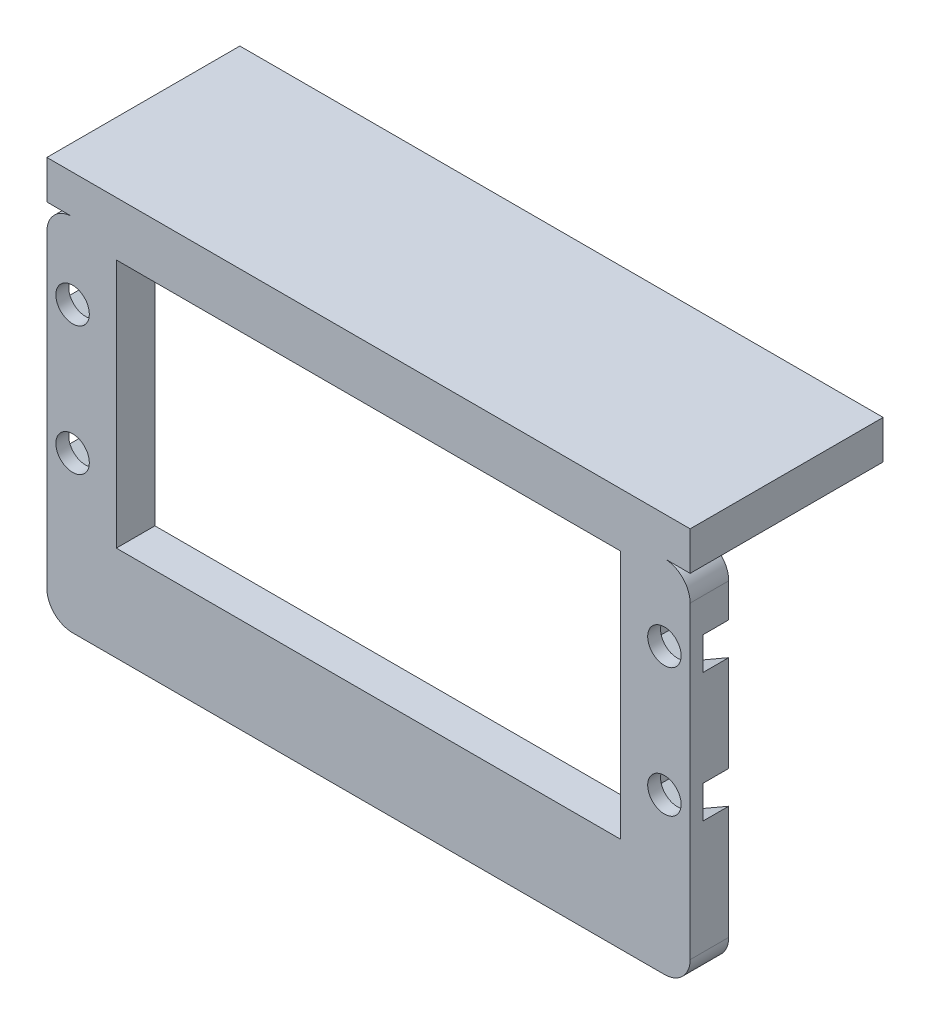
from build123d import *

# Parameters (mm, degrees)
BOSS_EXTRUDE1_DEPTH     = 3
CUT_EXTRUDE1_DEPTH      = 38.656340768
CUT_EXTRUDE1_DEPTH_BACK = 38.656340768
SKETCH2_W               = 39.2
SKETCH2_H               = 19.4
CUT_EXTRUDE2_DEPTH      = 38.656340768
CUT_EXTRUDE2_DEPTH_BACK = 38.656340768
SKETCH3_R               = 1.3
CUT_EXTRUDE3_DEPTH      = 2
SKETCH5_W               = 50
SKETCH5_H               = 15
BOSS_EXTRUDE2_DEPTH     = 3


with BuildPart() as part:
    # Sketch1 → Boss-Extrude1 (new body)
    with BuildSketch(Plane.XY):
        with BuildLine():
            Line((-23, -28), (23, -28))
            ThreePointArc((23, -28), (24.414213562, -27.414213562), (25, -26))
            Line((25, -26), (25, -2))
            ThreePointArc((25, -2), (24.414213562, -0.585786438), (23, 0))
            Line((23, 0), (-23, 0))
            ThreePointArc((-23, 0), (-24.414213562, -0.585786438), (-25, -2))
            Line((-25, -2), (-25, -26))
            ThreePointArc((-25, -26), (-24.414213562, -27.414213562), (-23, -28))
        make_face()
    extrude(amount=BOSS_EXTRUDE1_DEPTH)

    # Sketch2 → Cut-Extrude1 (cut, two sides: drawn at the far end of the back side and taken through both)
    with BuildSketch(Plane.XY.offset(-CUT_EXTRUDE1_DEPTH_BACK)):
        with Locations((0, -10.9)):
            Rectangle(SKETCH2_W, SKETCH2_H)
    extrude(amount=CUT_EXTRUDE1_DEPTH + CUT_EXTRUDE1_DEPTH_BACK, mode=Mode.SUBTRACT)

    # Sketch3 → Cut-Extrude2 (cut, two sides: drawn at the far end of the back side and taken through both)
    with BuildSketch(Plane.XY.offset(-CUT_EXTRUDE2_DEPTH_BACK)):
        with Locations((23, -5.9)):
            Circle(SKETCH3_R)
        with Locations((23, -15.9)):
            Circle(SKETCH3_R)
        with Locations((-23, -5.9)):
            Circle(SKETCH3_R)
        with Locations((-23, -15.9)):
            Circle(SKETCH3_R)
    extrude(amount=CUT_EXTRUDE2_DEPTH + CUT_EXTRUDE2_DEPTH_BACK, mode=Mode.SUBTRACT)

    # Sketch4 → Cut-Extrude3 (cut)
    with BuildSketch(Plane.XY):
        Polygon((25.1, -4.687564435), (23, -3.475128869), (20.9, -4.687564435), (20.9, -7.112435565), (23, -8.324871131), (25.1, -7.112435565), align=None)
        Polygon((25.1, -14.687564435), (23, -13.475128869), (20.9, -14.687564435), (20.9, -17.112435565), (23, -18.324871131), (25.1, -17.112435565), align=None)
        Polygon((-20.9, -4.687564435), (-23, -3.475128869), (-25.1, -4.687564435), (-25.1, -7.112435565), (-23, -8.324871131), (-20.9, -7.112435565), align=None)
        Polygon((-20.9, -14.687564435), (-23, -13.475128869), (-25.1, -14.687564435), (-25.1, -17.112435565), (-23, -18.324871131), (-20.9, -17.112435565), align=None)
    extrude(amount=CUT_EXTRUDE3_DEPTH, mode=Mode.SUBTRACT)

    # Sketch5 → Boss-Extrude2 (add)
    with BuildSketch(Plane(origin=(0, 0, 0), x_dir=(1, 0, 0), z_dir=(0, 1, 0))):
        with Locations((0, 4.5)):
            Rectangle(SKETCH5_W, SKETCH5_H)
    extrude(amount=BOSS_EXTRUDE2_DEPTH)


solid = part.part
